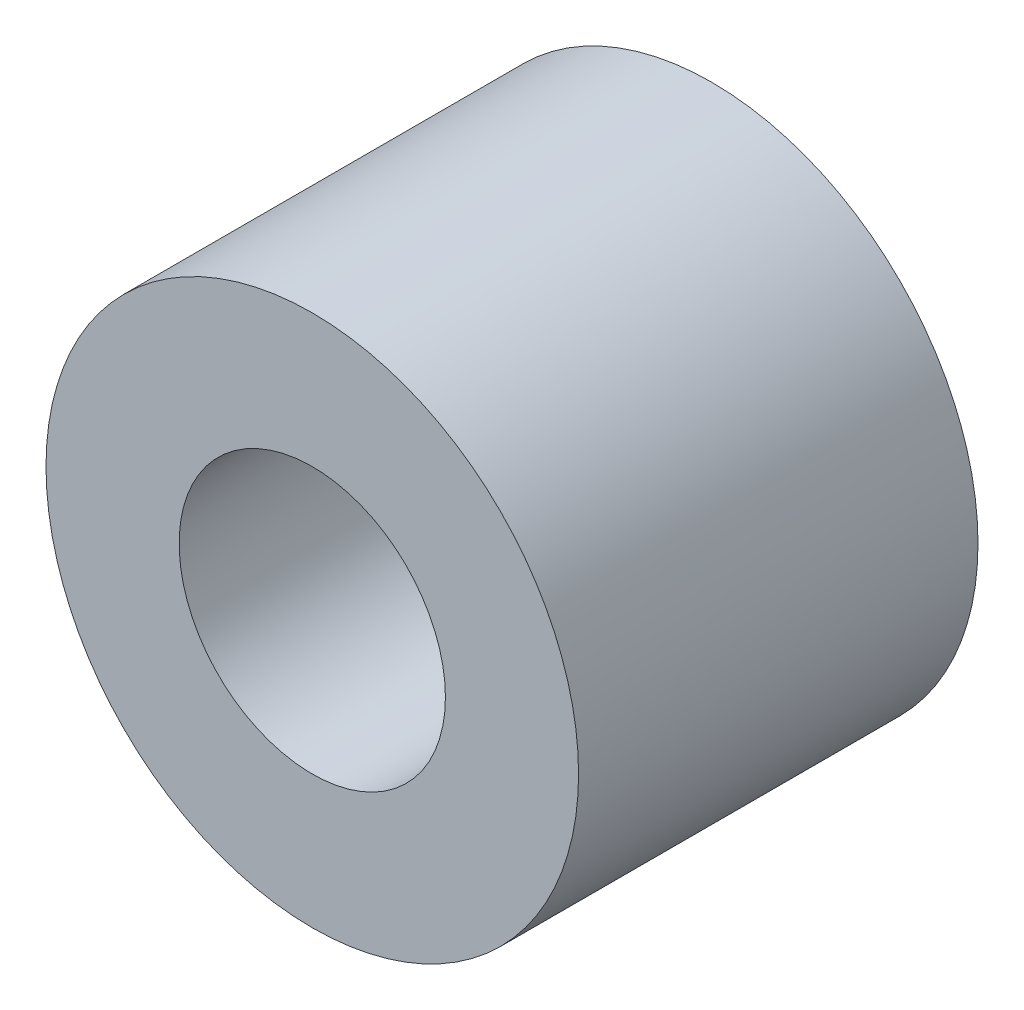
from build123d import *

# Parameters (mm, degrees)
SKETCH_1_R      = 4.5
SKETCH_1_R_2    = 2.25
EXTRUDE_1_DEPTH = 6.75


with BuildPart() as part:
    # 草图1 → 凸台-拉伸1 (new body)
    with BuildSketch(Plane.XY):
        Circle(SKETCH_1_R)
        Circle(SKETCH_1_R_2, mode=Mode.SUBTRACT)
    extrude(amount=EXTRUDE_1_DEPTH)


solid = part.part
